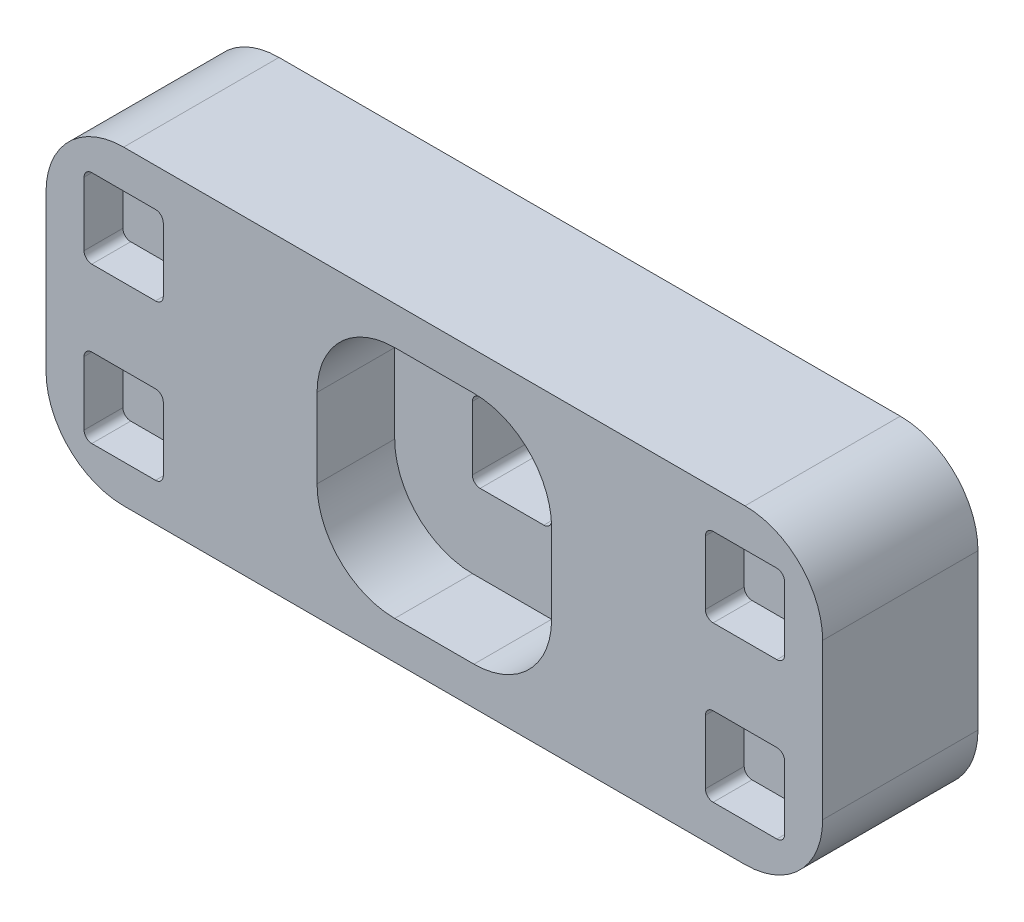
from build123d import *

# Parameters (mm, degrees)
SKETCH_1_W          = 100
SKETCH_1_H          = 40
EXTRUDE_1_DEPTH     = 20
FILLET_2_R          = 10
CUT_EXTRUDE_1_DEPTH = 10
CUT_EXTRUDE_2_DEPTH = 55.772255751
CUT_EXTRUDE_3_DEPTH = 5
CUT_EXTRUDE_4_DEPTH = 10


with BuildPart() as part:
    # ｽｹｯﾁ1 → ﾎﾞｽ - 押し出し1 (new body)
    with BuildSketch(Plane.XY):
        Rectangle(SKETCH_1_W, SKETCH_1_H)
    extrude(amount=EXTRUDE_1_DEPTH)

    # ﾌｨﾚｯﾄ2
    fillet_2_edges = [part.edges().sort_by_distance(p)[0] for p in [
        (50, -20, 10),
        (-50, -20, 10),
        (-50, 20, 10),
        (50, 20, 10),
    ]]
    fillet(fillet_2_edges, radius=FILLET_2_R)

    # ｽｹｯﾁ2 → ｶｯﾄ - 押し出し1 (cut)
    with BuildSketch(Plane.XY.offset(20)):
        with BuildLine():
            Line((-5.1, -15.1), (5.1, -15.1))
            ThreePointArc((5.1, -15.1), (12.171067812, -12.171067812), (15.1, -5.1))
            Line((15.1, -5.1), (15.1, 5.1))
            ThreePointArc((15.1, 5.1), (12.171067812, 12.171067812), (5.1, 15.1))
            Line((5.1, 15.1), (-5.1, 15.1))
            ThreePointArc((-5.1, 15.1), (-12.171067812, 12.171067812), (-15.1, 5.1))
            Line((-15.1, 5.1), (-15.1, -5.1))
            ThreePointArc((-15.1, -5.1), (-12.171067812, -12.171067812), (-5.1, -15.1))
        make_face()
    extrude(amount=-CUT_EXTRUDE_1_DEPTH, mode=Mode.SUBTRACT)

    # ｽｹｯﾁ3 → ｶｯﾄ - 押し出し2 (cut, through all)
    with BuildSketch(Plane.XY.offset(10)):
        with BuildLine():
            Line((-4.1, -5.1), (4.1, -5.1))
            ThreePointArc((4.1, -5.1), (4.807106781, -4.807106781), (5.1, -4.1))
            Line((5.1, -4.1), (5.1, 4.1))
            ThreePointArc((5.1, 4.1), (4.807106781, 4.807106781), (4.1, 5.1))
            Line((4.1, 5.1), (-4.1, 5.1))
            ThreePointArc((-4.1, 5.1), (-4.807106781, 4.807106781), (-5.1, 4.1))
            Line((-5.1, 4.1), (-5.1, -4.1))
            ThreePointArc((-5.1, -4.1), (-4.807106781, -4.807106781), (-4.1, -5.1))
        make_face()
    extrude(amount=-CUT_EXTRUDE_2_DEPTH, mode=Mode.SUBTRACT)

    # ｽｹｯﾁ4 → ｶｯﾄ - 押し出し3 (cut)
    with BuildSketch(Plane.XY.offset(20)):
        with BuildLine():
            Line((44.1, 15.1), (35.9, 15.1))
            ThreePointArc((35.9, 15.1), (35.192893219, 14.807106781), (34.9, 14.1))
            Line((34.9, 14.1), (34.9, 5.9))
            ThreePointArc((34.9, 5.9), (35.192893219, 5.192893219), (35.9, 4.9))
            Line((35.9, 4.9), (44.1, 4.9))
            ThreePointArc((44.1, 4.9), (44.807106781, 5.192893219), (45.1, 5.9))
            Line((45.1, 5.9), (45.1, 14.1))
            ThreePointArc((45.1, 14.1), (44.807106781, 14.807106781), (44.1, 15.1))
        make_face()
        with BuildLine():
            Line((-44.1, 4.9), (-35.9, 4.9))
            ThreePointArc((-35.9, 4.9), (-35.192893219, 5.192893219), (-34.9, 5.9))
            Line((-34.9, 5.9), (-34.9, 14.1))
            ThreePointArc((-34.9, 14.1), (-35.192893219, 14.807106781), (-35.9, 15.1))
            Line((-35.9, 15.1), (-44.1, 15.1))
            ThreePointArc((-44.1, 15.1), (-44.807106781, 14.807106781), (-45.1, 14.1))
            Line((-45.1, 14.1), (-45.1, 5.9))
            ThreePointArc((-45.1, 5.9), (-44.807106781, 5.192893219), (-44.1, 4.9))
        make_face()
        with BuildLine():
            Line((45.1, -5.9), (45.1, -14.1))
            ThreePointArc((45.1, -14.1), (44.807106781, -14.807106781), (44.1, -15.1))
            Line((44.1, -15.1), (35.9, -15.1))
            ThreePointArc((35.9, -15.1), (35.192893219, -14.807106781), (34.9, -14.1))
            Line((34.9, -14.1), (34.9, -5.9))
            ThreePointArc((34.9, -5.9), (35.192893219, -5.192893219), (35.9, -4.9))
            Line((35.9, -4.9), (44.1, -4.9))
            ThreePointArc((44.1, -4.9), (44.807106781, -5.192893219), (45.1, -5.9))
        make_face()
        with BuildLine():
            Line((-44.1, -15.1), (-35.9, -15.1))
            ThreePointArc((-35.9, -15.1), (-35.192893219, -14.807106781), (-34.9, -14.1))
            Line((-34.9, -14.1), (-34.9, -5.9))
            ThreePointArc((-34.9, -5.9), (-35.192893219, -5.192893219), (-35.9, -4.9))
            Line((-35.9, -4.9), (-44.1, -4.9))
            ThreePointArc((-44.1, -4.9), (-44.807106781, -5.192893219), (-45.1, -5.9))
            Line((-45.1, -5.9), (-45.1, -14.1))
            ThreePointArc((-45.1, -14.1), (-44.807106781, -14.807106781), (-44.1, -15.1))
        make_face()
    extrude(amount=-CUT_EXTRUDE_3_DEPTH, mode=Mode.SUBTRACT)

    # ｽｹｯﾁ5 → ｶｯﾄ - 押し出し4 (cut)
    with BuildSketch(Plane(origin=(0, 0, 0), x_dir=(-1, 0, 0), z_dir=(0, 0, -1))):
        with BuildLine():
            Line((-39, -10.1), (-20.8, -10.1))
            ThreePointArc((-20.8, -10.1), (-20.092893219, -9.807106781), (-19.8, -9.1))
            Line((-19.8, -9.1), (-19.8, 9.1))
            ThreePointArc((-19.8, 9.1), (-20.092893219, 9.807106781), (-20.8, 10.1))
            Line((-20.8, 10.1), (-39, 10.1))
            ThreePointArc((-39, 10.1), (-39.707106781, 9.807106781), (-40, 9.1))
            Line((-40, 9.1), (-40, -9.1))
            ThreePointArc((-40, -9.1), (-39.707106781, -9.807106781), (-39, -10.1))
        make_face()
        with BuildLine():
            Line((20.8, -10.1), (39, -10.1))
            ThreePointArc((39, -10.1), (39.707106781, -9.807106781), (40, -9.1))
            Line((40, -9.1), (40, 9.1))
            ThreePointArc((40, 9.1), (39.707106781, 9.807106781), (39, 10.1))
            Line((39, 10.1), (20.8, 10.1))
            ThreePointArc((20.8, 10.1), (20.092893219, 9.807106781), (19.8, 9.1))
            Line((19.8, 9.1), (19.8, -9.1))
            ThreePointArc((19.8, -9.1), (20.092893219, -9.807106781), (20.8, -10.1))
        make_face()
    extrude(amount=-CUT_EXTRUDE_4_DEPTH, mode=Mode.SUBTRACT)


solid = part.part
